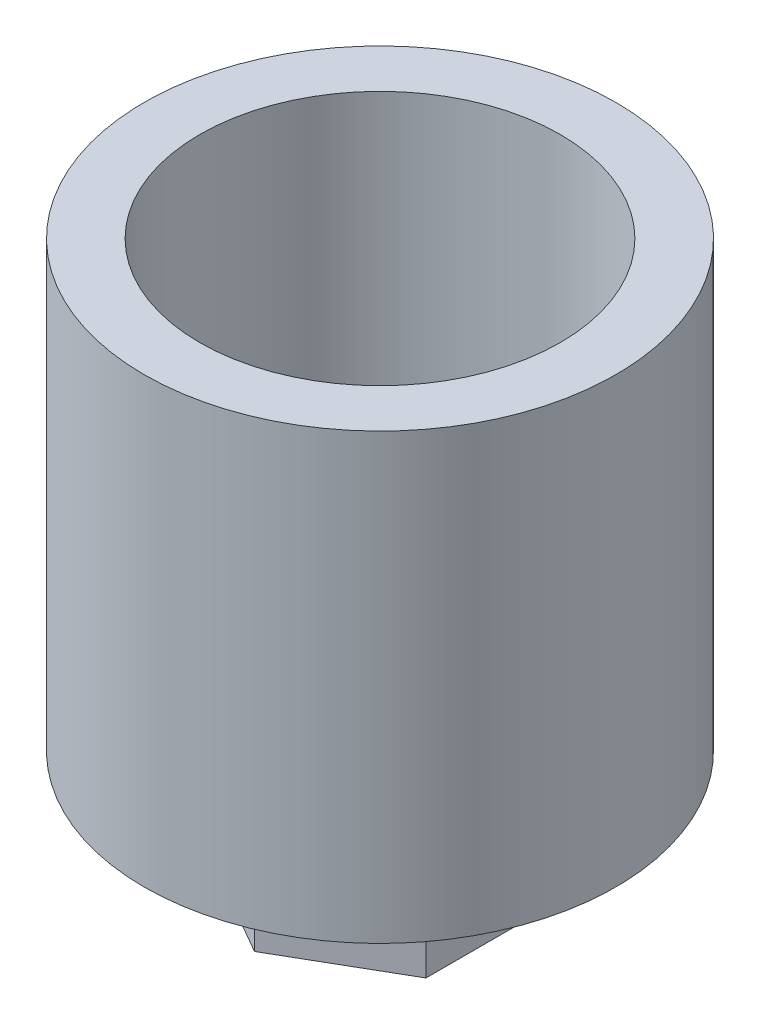
from build123d import *

# Parameters (mm, degrees)
SKETCH1_R                   = 13.5
BOSS_EXTRUDE1_DEPTH         = 25.4
F_7_8_14_TAPPED_HOLE1_D     = 20.6375
F_7_8_14_TAPPED_HOLE1_DEPTH = 19.05
F_7_8_14_TAPPED_HOLE1_TIP   = 6.200130513
BOSS_EXTRUDE2_DEPTH         = 6.35


with BuildPart() as part:
    # Sketch1 → Boss-Extrude1 (new body)
    with BuildSketch(Plane(origin=(0, 0, 0), x_dir=(1, 0, 0), z_dir=(0, 1, 0))):
        with Locations(Location((0, 0, 0), (0, 0, 270))):
            Circle(SKETCH1_R)
    extrude(amount=BOSS_EXTRUDE1_DEPTH)

    # 7/8-14 Tapped Hole1
    with Locations(Plane(origin=(0, 25.4, 0), x_dir=(1, 0, 0), z_dir=(0, 1, 0))):
        with Locations((0, 0)):
            Hole(F_7_8_14_TAPPED_HOLE1_D / 2, depth=F_7_8_14_TAPPED_HOLE1_DEPTH)
            with Locations((0, 0, -(F_7_8_14_TAPPED_HOLE1_DEPTH + F_7_8_14_TAPPED_HOLE1_TIP / 2))):  # 118° drill point
                Cone(0, F_7_8_14_TAPPED_HOLE1_D / 2, F_7_8_14_TAPPED_HOLE1_TIP, mode=Mode.SUBTRACT)

    # Sketch6 → Boss-Extrude2 (add)
    with BuildSketch(Plane.XZ):
        Polygon((6.223, 3.592850725), (0, 7.18570145), (-6.223, 3.592850725), (-6.223, -3.592850725), (0, -7.18570145), (6.223, -3.592850725), align=None)
    extrude(amount=BOSS_EXTRUDE2_DEPTH)


solid = part.part
